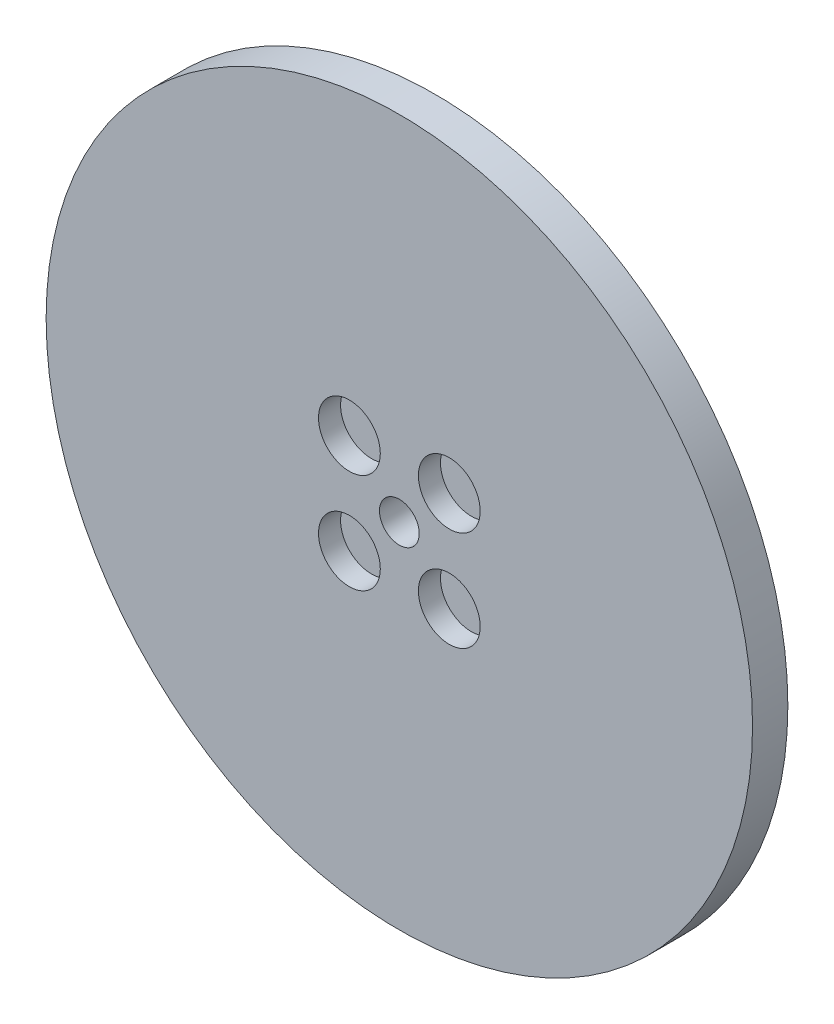
from build123d import *

# Parameters (mm, degrees)
SKETCH1_R           = 30
SKETCH1_R_2         = 12.5
BOSS_EXTRUDE1_DEPTH = 4
SKETCH2_R           = 40
SKETCH2_R_2         = 2.25
SKETCH2_R_3         = 1.5
BOSS_EXTRUDE2_DEPTH = 4
SKETCH3_R           = 3.5
CUT_EXTRUDE1_DEPTH  = 2.5
SKETCH4_R           = 5.15
SKETCH4_R_2         = 2.65
CUT_EXTRUDE2_DEPTH  = 3
SKETCH5_R           = 3.5
BOSS_EXTRUDE3_DEPTH = 0.2


with BuildPart() as part:
    # Sketch1 → Boss-Extrude1 (new body)
    with BuildSketch(Plane.XY):
        Circle(SKETCH1_R)
        Circle(SKETCH1_R_2, mode=Mode.SUBTRACT)
    extrude(amount=BOSS_EXTRUDE1_DEPTH)

    # Sketch2 → Boss-Extrude2 (add)
    with BuildSketch(Plane.XY.offset(4)):
        Circle(SKETCH2_R)
        Circle(SKETCH2_R_2, mode=Mode.SUBTRACT)
        with Locations((-5.655999742, 5.657708628)):
            Circle(SKETCH2_R_3, mode=Mode.SUBTRACT)
        with Locations((-5.655999742, -5.657708628)):
            Circle(SKETCH2_R_3, mode=Mode.SUBTRACT)
        with Locations((5.655999742, -5.657708628)):
            Circle(SKETCH2_R_3, mode=Mode.SUBTRACT)
        with Locations((5.655999742, 5.657708628)):
            Circle(SKETCH2_R_3, mode=Mode.SUBTRACT)
    extrude(amount=BOSS_EXTRUDE2_DEPTH)

    # Sketch3 → Cut-Extrude1 (cut)
    with BuildSketch(Plane.XY.offset(8)):
        with Locations((-5.655999742, 5.657708628)):
            Circle(SKETCH3_R)
        with Locations((5.655999742, 5.657708628)):
            Circle(SKETCH3_R)
        with Locations((5.655999742, -5.657708628)):
            Circle(SKETCH3_R)
        with Locations((-5.655999742, -5.657708628)):
            Circle(SKETCH3_R)
    extrude(amount=-CUT_EXTRUDE1_DEPTH, mode=Mode.SUBTRACT)

    # Sketch4 → Cut-Extrude2 (cut)
    with BuildSketch(Plane(origin=(0, 0, 0), x_dir=(-1, 0, 0), z_dir=(0, 0, -1))):
        with Locations((-20, 0)):
            Circle(SKETCH4_R)
        with Locations((0, -20)):
            Circle(SKETCH4_R)
        with Locations((20, 0)):
            Circle(SKETCH4_R)
        with Locations((0, 20)):
            Circle(SKETCH4_R)
        with Locations((14.142135624, 14.142135624)):
            Circle(SKETCH4_R_2)
        with Locations((14.142135624, -14.142135624)):
            Circle(SKETCH4_R_2)
        with Locations((-14.142135624, -14.142135624)):
            Circle(SKETCH4_R_2)
        with Locations((-14.142135624, 14.142135624)):
            Circle(SKETCH4_R_2)
    extrude(amount=-CUT_EXTRUDE2_DEPTH, mode=Mode.SUBTRACT)

    # Sketch5 → Boss-Extrude3 (add)
    with BuildSketch(Plane.XY.offset(5.5)):
        with Locations((-5.655999742, 5.657708628)):
            Circle(SKETCH5_R)
        with Locations((5.655999742, 5.657708628)):
            Circle(SKETCH5_R)
        with Locations((-5.655999742, -5.657708628)):
            Circle(SKETCH5_R)
        with Locations((5.655999742, -5.657708628)):
            Circle(SKETCH5_R)
    extrude(amount=-BOSS_EXTRUDE3_DEPTH)


solid = part.part
